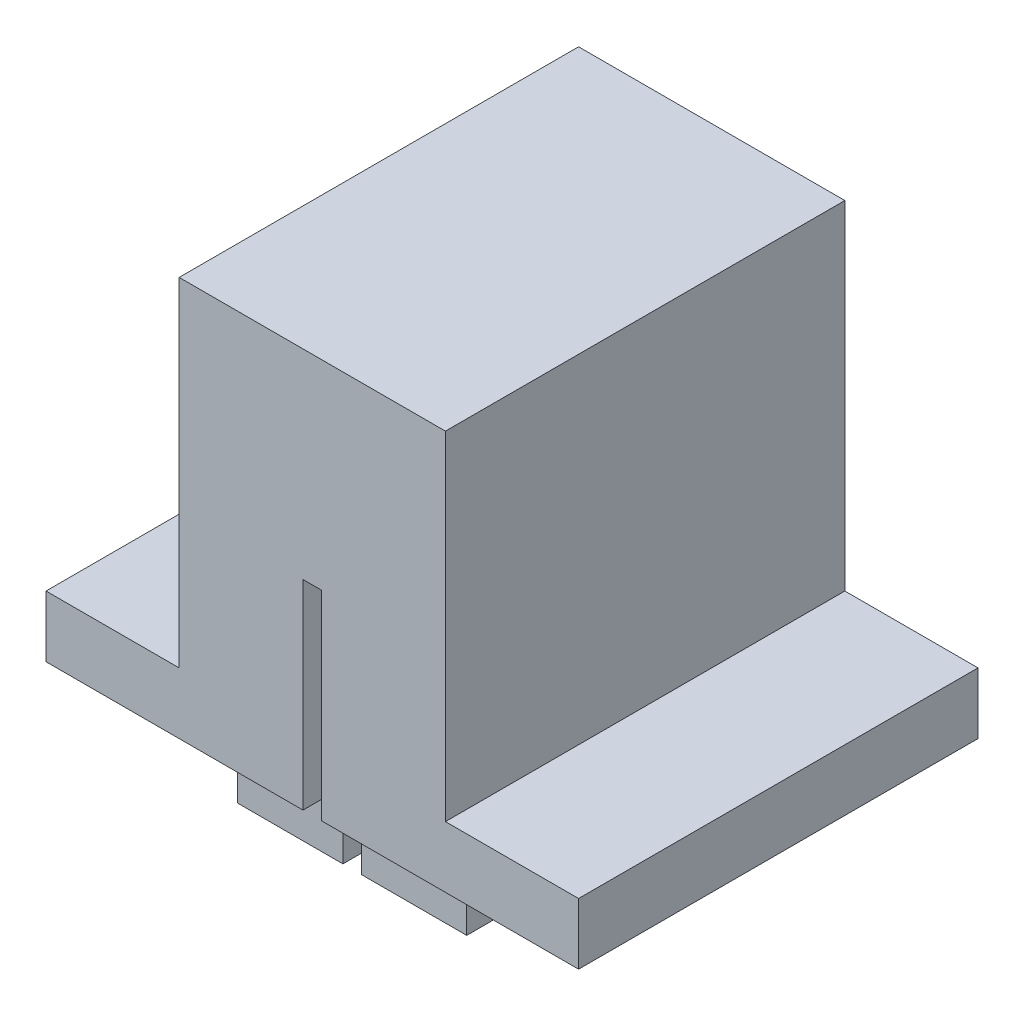
from build123d import *

# Parameters (mm, degrees)
SKETCH1_W               = 10
SKETCH1_H               = 15
BOSS_EXTRUDE1_DEPTH     = 15
CUT_EXTRUDE1_DEPTH      = 18.5
CUT_EXTRUDE1_DEPTH_BACK = 18.5
SKETCH2_W               = 0.7
SKETCH2_H               = 10
SKETCH3_W               = 5
SKETCH3_H               = 2.3
SKETCH3_W_2             = 10
SKETCH3_H_2             = 2.5
BOSS_EXTRUDE2_DEPTH     = 15
CUT_EXTRUDE2_DEPTH      = 24.452078799
CUT_EXTRUDE2_DEPTH_BACK = 24.452078799
SKETCH4_W               = 1.5
SKETCH4_H               = 2.5
CUT_EXTRUDE3_DEPTH      = 21.615528128
CUT_EXTRUDE3_DEPTH_BACK = 21.615528128
SKETCH5_W               = 0.7
SKETCH5_H               = 2.5


with BuildPart() as part:
    # Sketch1 → Boss-Extrude1 (new body)
    with BuildSketch(Plane.XY):
        Rectangle(SKETCH1_W, SKETCH1_H)
    extrude(amount=BOSS_EXTRUDE1_DEPTH)

    # Sketch2 → Cut-Extrude1 (cut, two sides: drawn at the far end of the back side and taken through both)
    with BuildSketch(Plane.XY.offset(15).offset(-CUT_EXTRUDE1_DEPTH_BACK)):
        with Locations((0, -2.5)):
            Rectangle(SKETCH2_W, SKETCH2_H)
    extrude(amount=CUT_EXTRUDE1_DEPTH + CUT_EXTRUDE1_DEPTH_BACK, mode=Mode.SUBTRACT)

    # Sketch3 → Boss-Extrude2 (add)
    with BuildSketch(Plane.XY.offset(15)):
        with Locations((-7.5, -3.85)):
            Rectangle(SKETCH3_W, SKETCH3_H)
        with Locations((7.5, -3.85)):
            Rectangle(SKETCH3_W, SKETCH3_H)
        with Locations((0, 8.75)):
            Rectangle(SKETCH3_W_2, SKETCH3_H_2)
    extrude(amount=-BOSS_EXTRUDE2_DEPTH)

    # Sketch4 → Cut-Extrude2 (cut, two sides: drawn at the far end of the back side and taken through both)
    with BuildSketch(Plane.ZY.offset(5).offset(-CUT_EXTRUDE2_DEPTH_BACK)):
        with Locations((0.75, -6.25)):
            Rectangle(SKETCH4_W, SKETCH4_H)
        with Locations((14.25, -6.25)):
            Rectangle(SKETCH4_W, SKETCH4_H)
    extrude(amount=CUT_EXTRUDE2_DEPTH + CUT_EXTRUDE2_DEPTH_BACK, mode=Mode.SUBTRACT)

    # Sketch5 → Cut-Extrude3 (cut, two sides: drawn at the far end of the back side and taken through both)
    with BuildSketch(Plane(origin=(0, 0, 0), x_dir=(-1, 0, 0), z_dir=(0, 0, -1)).offset(-CUT_EXTRUDE3_DEPTH_BACK)):
        with Locations((4.65, -6.25)):
            Rectangle(SKETCH5_W, SKETCH5_H)
        with Locations((-4.65, -6.25)):
            Rectangle(SKETCH5_W, SKETCH5_H)
    extrude(amount=CUT_EXTRUDE3_DEPTH + CUT_EXTRUDE3_DEPTH_BACK, mode=Mode.SUBTRACT)


solid = part.part
